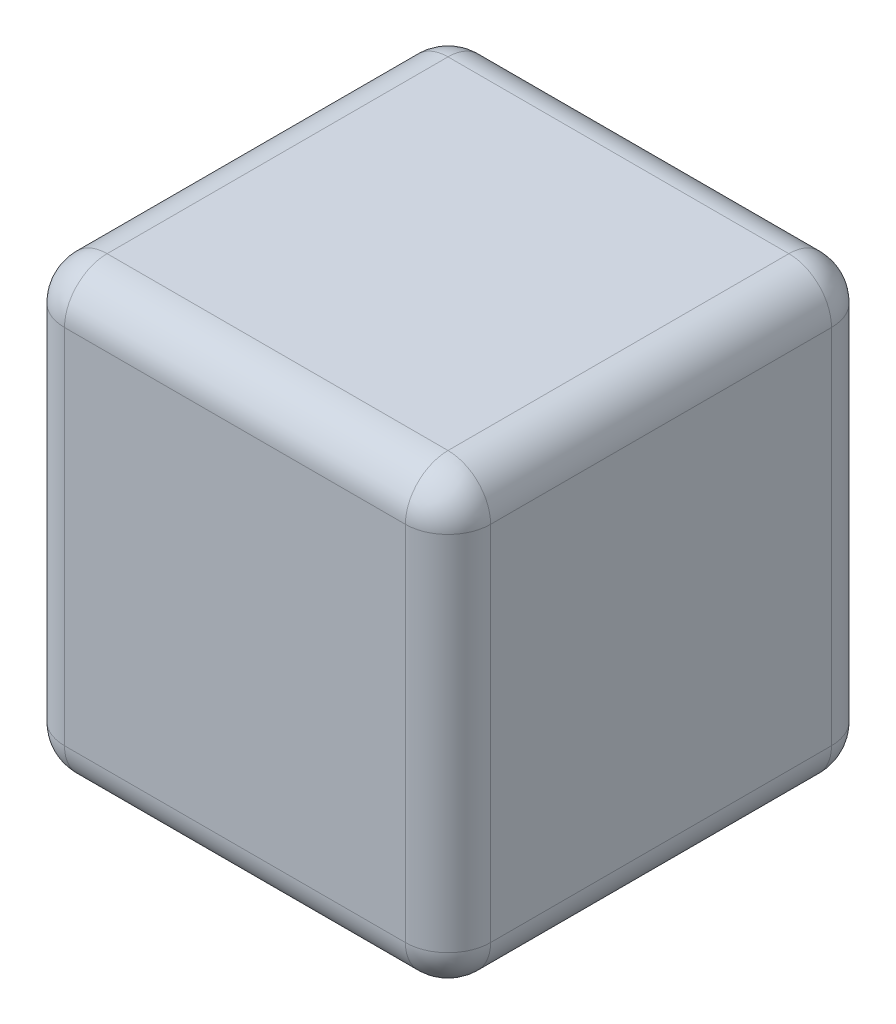
from build123d import *

# Parameters (mm, degrees)
SKETCH1_W           = 100
SKETCH1_H           = 100
BOSS_EXTRUDE1_DEPTH = 105
FILLET1_R           = 10


with BuildPart() as part:
    # Sketch1 → Boss-Extrude1 (new body)
    with BuildSketch(Plane(origin=(0, 0, 0), x_dir=(1, 0, 0), z_dir=(0, 1, 0))):
        with Locations((50, 50)):
            Rectangle(SKETCH1_W, SKETCH1_H)
    extrude(amount=BOSS_EXTRUDE1_DEPTH)

    # Fillet1
    fillet1_edges = [part.edges().sort_by_distance(p)[0] for p in [
        (100, 105, -50),
        (50, 105, -100),
        (0, 105, -50),
        (50, 0, -100),
        (100, 0, -50),
        (50, 0, 0),
        (0, 0, -50),
        (0, 52.5, -100),
        (100, 52.5, -100),
        (100, 52.5, 0),
        (0, 52.5, 0),
        (50, 105, 0),
    ]]
    fillet(fillet1_edges, radius=FILLET1_R)


solid = part.part
